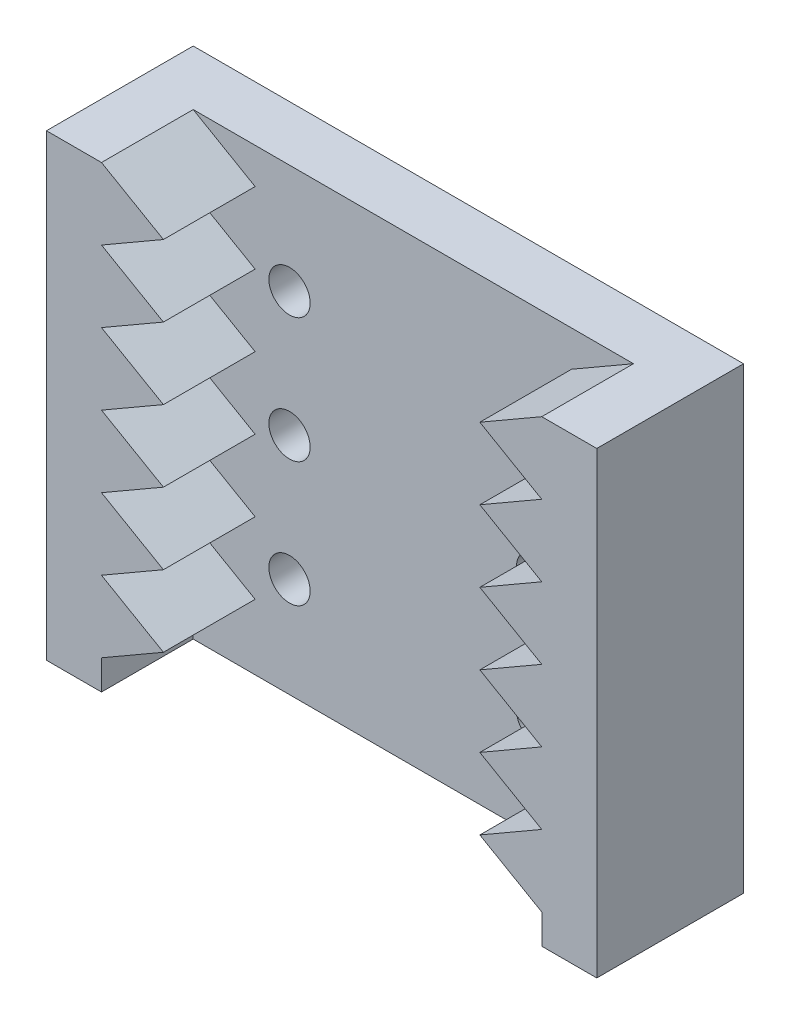
from build123d import *

# Parameters (mm, degrees)
SKETCH1_W           = 24
SKETCH1_H           = 25
SKETCH1_R           = 1.125
BOSS_EXTRUDE1_DEPTH = 3
BOSS_EXTRUDE2_DEPTH = 8


with BuildPart() as part:
    # Sketch1 → Boss-Extrude1 (new body)
    with BuildSketch(Plane.XY):
        Rectangle(SKETCH1_W, SKETCH1_H)
        with Locations((-6.75, 6.55)):
            Circle(SKETCH1_R, mode=Mode.SUBTRACT)
        with Locations((-6.75, -0.25)):
            Circle(SKETCH1_R, mode=Mode.SUBTRACT)
        with Locations((-6.75, -7.05)):
            Circle(SKETCH1_R, mode=Mode.SUBTRACT)
        with Locations((6.75, -7.05)):
            Circle(SKETCH1_R, mode=Mode.SUBTRACT)
        with Locations((6.75, -0.25)):
            Circle(SKETCH1_R, mode=Mode.SUBTRACT)
        with Locations((6.75, 6.55)):
            Circle(SKETCH1_R, mode=Mode.SUBTRACT)
    extrude(amount=BOSS_EXTRUDE1_DEPTH)

    # Sketch2 → Boss-Extrude2 (add)
    with BuildSketch(Plane.XY):
        Polygon((-12, 12.5), (-15, 12.5), (-15, -12.5), (-12, -12.5), (-12, -10.882685902), (-8.625, -8.934128744), (-12, -6.985571585), (-8.625, -5.037014427), (-12, -3.088457268), (-8.625, -1.13990011), (-12, 0.808657049), (-8.625, 2.757214207), (-12, 4.705771366), (-8.625, 6.654328524), (-12, 8.602885683), (-8.625, 10.551442841), align=None)
        Polygon((12, -3.088457268), (8.625, -5.037014427), (12, -6.985571585), (8.625, -8.934128744), (12, -10.882685902), (12, -12.5), (15, -12.5), (15, 12.5), (12, 12.5), (8.625, 10.551442841), (12, 8.602885683), (8.625, 6.654328524), (12, 4.705771366), (8.625, 2.757214207), (12, 0.808657049), (8.625, -1.13990011), align=None)
    extrude(amount=BOSS_EXTRUDE2_DEPTH)


solid = part.part
